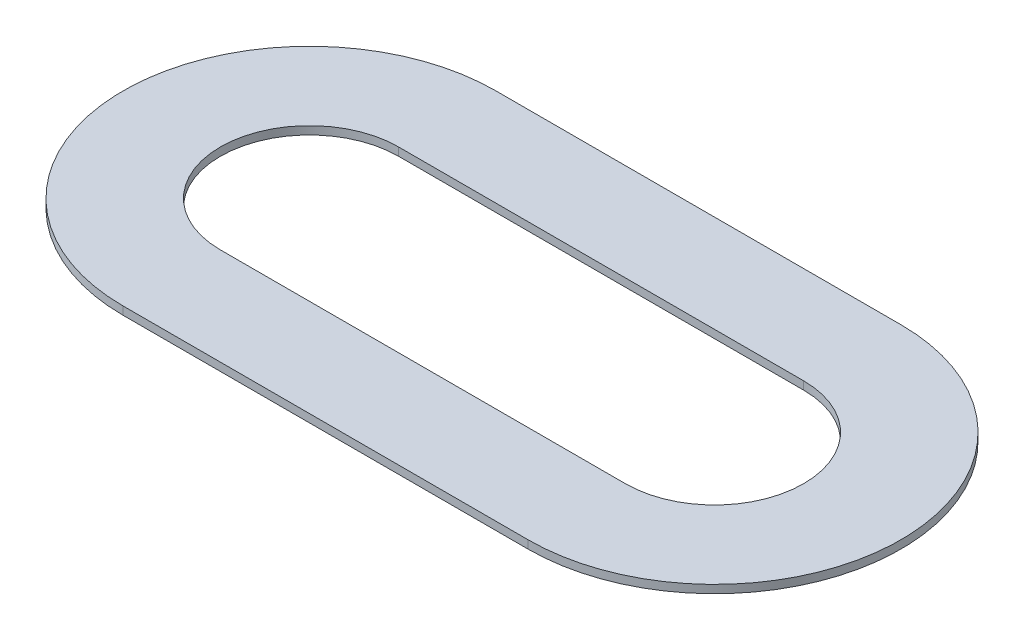
from build123d import *

# Parameters (mm, degrees)
EXTRUDE_1_DEPTH = 10


with BuildPart() as part:
    # 草图1 → 凸台-拉伸1 (new body)
    with BuildSketch(Plane(origin=(0, 0, 0), x_dir=(1, 0, 0), z_dir=(0, 1, 0))):
        with BuildLine():
            Line((-250, 230), (250, 230))
            ThreePointArc((250, 230), (480, 0), (250, -230))
            Line((250, -230), (-250, -230))
            ThreePointArc((-250, -230), (-480, 0), (-250, 230))
        make_face()
        with BuildLine():
            Line((-250, 110), (250, 110))
            ThreePointArc((250, 110), (360, 0), (250, -110))
            Line((250, -110), (-250, -110))
            ThreePointArc((-250, -110), (-360, 0), (-250, 110))
        make_face(mode=Mode.SUBTRACT)
    extrude(amount=EXTRUDE_1_DEPTH)


solid = part.part
